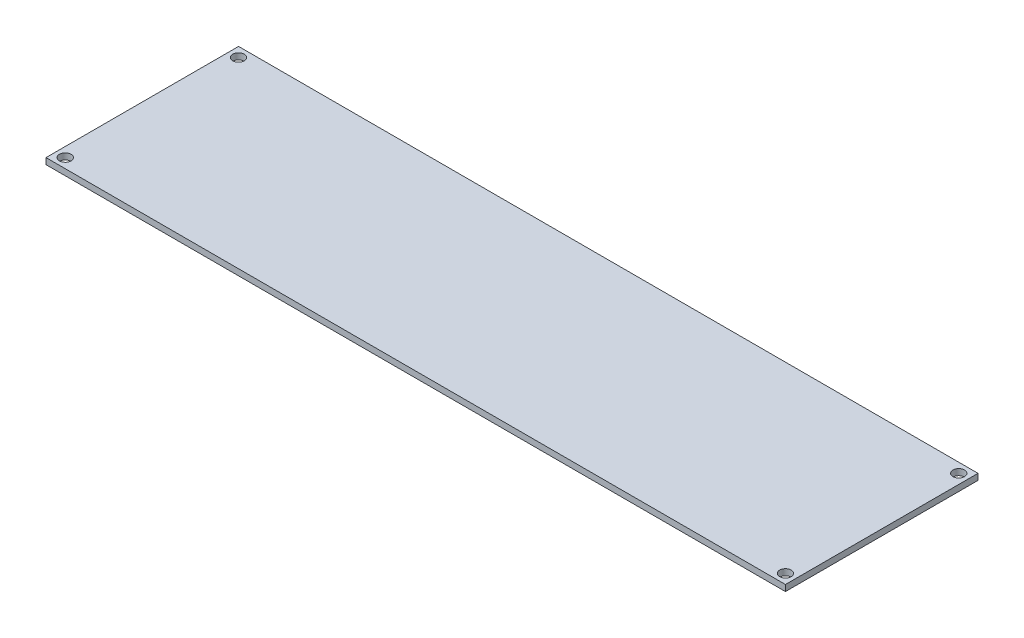
from build123d import *

# Parameters (mm, degrees)
SKETCH1_W           = 192
SKETCH1_H           = 50
BOSS_EXTRUDE1_DEPTH = 1.6
SKETCH2_R           = 1.5
CUT_EXTRUDE1_DEPTH  = 1.6


with BuildPart() as part:
    # Sketch1 → Boss-Extrude1 (new body)
    with BuildSketch(Plane(origin=(0, 0, 0), x_dir=(1, 0, 0), z_dir=(0, 1, 0))):
        with Locations((96, 25)):
            Rectangle(SKETCH1_W, SKETCH1_H)
    extrude(amount=BOSS_EXTRUDE1_DEPTH)

    # Sketch2 → Cut-Extrude1 (cut)
    with BuildSketch(Plane.XZ):
        with Locations(Location((2.5, -2.5, 0), (0, 0, 270))):
            Circle(SKETCH2_R)
        with Locations(Location((189.5, -2.5, 0), (0, 0, 270))):
            Circle(SKETCH2_R)
        with Locations(Location((189.5, -47.5, 0), (0, 0, 270))):
            Circle(SKETCH2_R)
        with Locations(Location((2.5, -47.5, 0), (0, 0, 270))):
            Circle(SKETCH2_R)
    extrude(amount=-CUT_EXTRUDE1_DEPTH, mode=Mode.SUBTRACT)


solid = part.part
